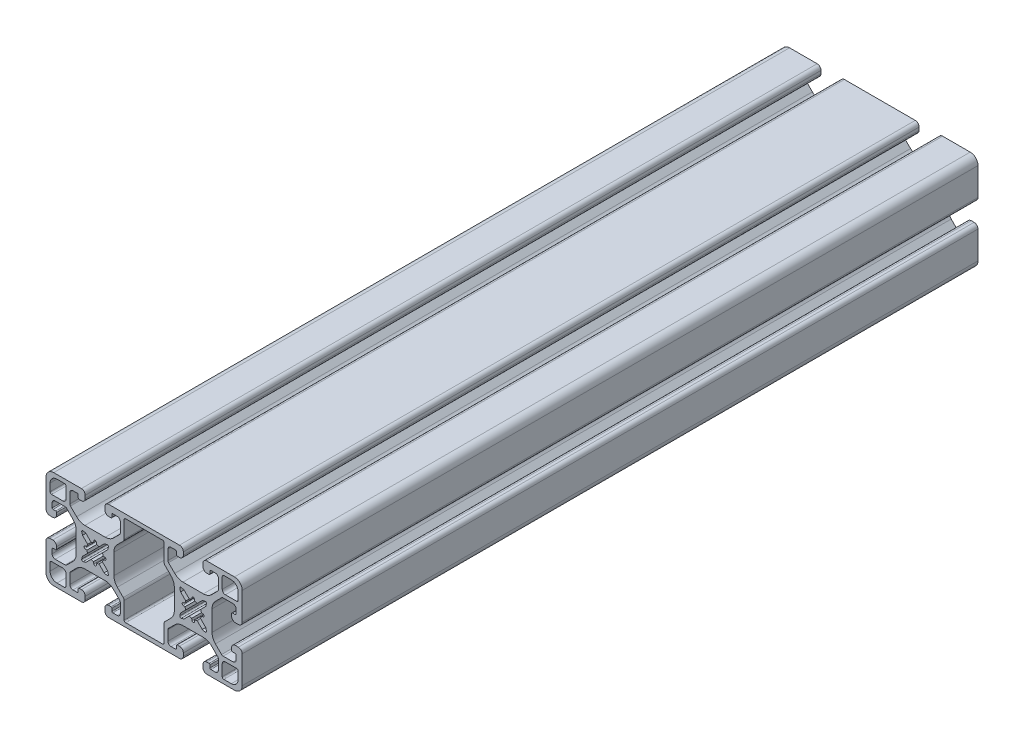
from build123d import *

# Parameters (mm, degrees)
EXTRUDE1_DEPTH = 300


with BuildPart() as part:
    # Sketch1 → Extrude1 (new body)
    with BuildSketch(Plane.XY):
        with BuildLine():
            Line((-24, -18.484793301), (-24, -17.255))
            ThreePointArc((-24, -17.255), (-24.459842354, -16.144842354), (-25.57, -15.685))
            Line((-25.57, -15.685), (-26.474, -15.685))
            ThreePointArc((-26.474, -15.685), (-26.743407684, -15.796592316), (-26.855, -16.066))
            Line((-26.855, -16.066), (-26.855, -17.119))
            ThreePointArc((-26.855, -17.119), (-26.966592316, -17.388407684), (-27.236, -17.5))
            Line((-27.236, -17.5), (-29.015, -17.5))
            ThreePointArc((-29.015, -17.5), (-29.913025612, -17.128025612), (-30.285, -16.23))
            Line((-30.285, -16.23), (-30.285, -12.216214636))
            ThreePointArc((-30.285, -12.216214636), (-30.217252784, -11.875626381), (-30.024325035, -11.5868896))
            Line((-30.024325035, -11.5868896), (-27.513678224, -9.076242789))
            ThreePointArc((-27.513678224, -9.076242789), (-25.972667317, -8.046572221), (-24.154921014, -7.685))
            Line((-24.154921014, -7.685), (-15.845078986, -7.685))
            ThreePointArc((-15.845078986, -7.685), (-14.027332683, -8.046572221), (-12.486321776, -9.076242789))
            Line((-12.486321776, -9.076242789), (-9.975674965, -11.5868896))
            ThreePointArc((-9.975674965, -11.5868896), (-9.782747216, -11.875626381), (-9.715, -12.216214636))
            Line((-9.715, -12.216214636), (-9.715, -16.23))
            ThreePointArc((-9.715, -16.23), (-10.086974388, -17.128025612), (-10.985, -17.5))
            Line((-10.985, -17.5), (-12.764, -17.5))
            ThreePointArc((-12.764, -17.5), (-13.033407684, -17.388407684), (-13.145, -17.119))
            Line((-13.145, -17.119), (-13.145, -16.066))
            ThreePointArc((-13.145, -16.066), (-13.256592316, -15.796592316), (-13.526, -15.685))
            Line((-13.526, -15.685), (-14.43, -15.685))
            ThreePointArc((-14.43, -15.685), (-15.540157646, -16.144842354), (-16, -17.255))
            Line((-16, -17.255), (-16, -18.484793301))
            ThreePointArc((-16, -18.484793301), (-15.521569689, -19.559363866), (-14.43095644, -20))
            Line((-14.43095644, -20), (14.43, -20))
            ThreePointArc((14.43, -20), (15.540157646, -19.540157646), (16, -18.43))
            Line((16, -18.43), (16, -17.255))
            ThreePointArc((16, -17.255), (15.540157646, -16.144842354), (14.43, -15.685))
            Line((14.43, -15.685), (13.526, -15.685))
            ThreePointArc((13.526, -15.685), (13.256592316, -15.796592316), (13.145, -16.066))
            Line((13.145, -16.066), (13.145, -17.119))
            ThreePointArc((13.145, -17.119), (13.033407684, -17.388407684), (12.764, -17.5))
            Line((12.764, -17.5), (10.985, -17.5))
            ThreePointArc((10.985, -17.5), (10.086974388, -17.128025612), (9.715, -16.23))
            Line((9.715, -16.23), (9.715, -12.216214636))
            ThreePointArc((9.715, -12.216214636), (9.782747216, -11.875626381), (9.975674965, -11.5868896))
            Line((9.975674965, -11.5868896), (12.486321776, -9.076242789))
            ThreePointArc((12.486321776, -9.076242789), (14.027332683, -8.046572221), (15.845078986, -7.685))
            Line((15.845078986, -7.685), (24.154921014, -7.685))
            ThreePointArc((24.154921014, -7.685), (25.972667317, -8.046572221), (27.513678224, -9.076242789))
            Line((27.513678224, -9.076242789), (30.024325035, -11.5868896))
            ThreePointArc((30.024325035, -11.5868896), (30.217252784, -11.875626381), (30.285, -12.216214636))
            Line((30.285, -12.216214636), (30.285, -16.23))
            ThreePointArc((30.285, -16.23), (29.913025612, -17.128025612), (29.015, -17.5))
            Line((29.015, -17.5), (27.236, -17.5))
            ThreePointArc((27.236, -17.5), (26.966592316, -17.388407684), (26.855, -17.119))
            Line((26.855, -17.119), (26.855, -16.066))
            ThreePointArc((26.855, -16.066), (26.743407684, -15.796592316), (26.474, -15.685))
            Line((26.474, -15.685), (25.57, -15.685))
            ThreePointArc((25.57, -15.685), (24.459842354, -16.144842354), (24, -17.255))
            Line((24, -17.255), (24, -18.43))
            ThreePointArc((24, -18.43), (24.459842354, -19.540157646), (25.57, -20))
            Line((25.57, -20), (36.83, -20))
            ThreePointArc((36.83, -20), (39.071528496, -19.071528496), (40, -16.83))
            Line((40, -16.83), (40, -5.57))
            ThreePointArc((40, -5.57), (39.540157646, -4.459842354), (38.43, -4))
            Line((38.43, -4), (37.255, -4))
            ThreePointArc((37.255, -4), (36.144842354, -4.459842354), (35.685, -5.57))
            Line((35.685, -5.57), (35.685, -6.474))
            ThreePointArc((35.685, -6.474), (35.796592316, -6.743407684), (36.066, -6.855))
            Line((36.066, -6.855), (37.119, -6.855))
            ThreePointArc((37.119, -6.855), (37.388407684, -6.966592316), (37.5, -7.236))
            Line((37.5, -7.236), (37.5, -9.015))
            ThreePointArc((37.5, -9.015), (37.128025612, -9.913025612), (36.23, -10.285))
            Line((36.23, -10.285), (32.216214636, -10.285))
            ThreePointArc((32.216214636, -10.285), (31.875626381, -10.217252784), (31.5868896, -10.024325035))
            Line((31.5868896, -10.024325035), (29.076242789, -7.513678224))
            ThreePointArc((29.076242789, -7.513678224), (28.046572221, -5.972667317), (27.685, -4.154921014))
            Line((27.685, -4.154921014), (27.685, 4.154921014))
            ThreePointArc((27.685, 4.154921014), (28.046572221, 5.972667317), (29.076242789, 7.513678224))
            Line((29.076242789, 7.513678224), (31.5868896, 10.024325035))
            ThreePointArc((31.5868896, 10.024325035), (31.875626381, 10.217252784), (32.216214636, 10.285))
            Line((32.216214636, 10.285), (36.23, 10.285))
            ThreePointArc((36.23, 10.285), (37.128025612, 9.913025612), (37.5, 9.015))
            Line((37.5, 9.015), (37.5, 7.236))
            ThreePointArc((37.5, 7.236), (37.388407684, 6.966592316), (37.119, 6.855))
            Line((37.119, 6.855), (36.066, 6.855))
            ThreePointArc((36.066, 6.855), (35.796592316, 6.743407684), (35.685, 6.474))
            Line((35.685, 6.474), (35.685, 5.57))
            ThreePointArc((35.685, 5.57), (36.144842354, 4.459842354), (37.255, 4))
            Line((37.255, 4), (38.43, 4))
            ThreePointArc((38.43, 4), (39.540157646, 4.459842354), (40, 5.57))
            Line((40, 5.57), (40, 16.83))
            ThreePointArc((40, 16.83), (39.071528496, 19.071528496), (36.83, 20))
            Line((36.83, 20), (25.57, 20))
            ThreePointArc((25.57, 20), (24.459842354, 19.540157646), (24, 18.43))
            Line((24, 18.43), (24, 17.255))
            ThreePointArc((24, 17.255), (24.459842354, 16.144842354), (25.57, 15.685))
            Line((25.57, 15.685), (26.474, 15.685))
            ThreePointArc((26.474, 15.685), (26.743407684, 15.796592316), (26.855, 16.066))
            Line((26.855, 16.066), (26.855, 17.119))
            ThreePointArc((26.855, 17.119), (26.966592316, 17.388407684), (27.236, 17.5))
            Line((27.236, 17.5), (29.015, 17.5))
            ThreePointArc((29.015, 17.5), (29.913025612, 17.128025612), (30.285, 16.23))
            Line((30.285, 16.23), (30.285, 12.216214636))
            ThreePointArc((30.285, 12.216214636), (30.217252784, 11.875626381), (30.024325035, 11.5868896))
            Line((30.024325035, 11.5868896), (27.513678224, 9.076242789))
            ThreePointArc((27.513678224, 9.076242789), (25.972667317, 8.046572221), (24.154921014, 7.685))
            Line((24.154921014, 7.685), (15.845078986, 7.685))
            ThreePointArc((15.845078986, 7.685), (14.027332683, 8.046572221), (12.486321776, 9.076242789))
            Line((12.486321776, 9.076242789), (9.975674965, 11.5868896))
            ThreePointArc((9.975674965, 11.5868896), (9.782747216, 11.875626381), (9.715, 12.216214636))
            Line((9.715, 12.216214636), (9.715, 16.23))
            ThreePointArc((9.715, 16.23), (10.086974388, 17.128025612), (10.985, 17.5))
            Line((10.985, 17.5), (12.764, 17.5))
            ThreePointArc((12.764, 17.5), (13.033407684, 17.388407684), (13.145, 17.119))
            Line((13.145, 17.119), (13.145, 16.066))
            ThreePointArc((13.145, 16.066), (13.256592316, 15.796592316), (13.526, 15.685))
            Line((13.526, 15.685), (14.43, 15.685))
            ThreePointArc((14.43, 15.685), (15.540157646, 16.144842354), (16, 17.255))
            Line((16, 17.255), (16, 18.43))
            ThreePointArc((16, 18.43), (15.540157646, 19.540157646), (14.43, 20))
            Line((14.43, 20), (-14.43, 20))
            ThreePointArc((-14.43, 20), (-15.540157646, 19.540157646), (-16, 18.43))
            Line((-16, 18.43), (-16, 17.255))
            ThreePointArc((-16, 17.255), (-15.540157646, 16.144842354), (-14.43, 15.685))
            Line((-14.43, 15.685), (-13.526, 15.685))
            ThreePointArc((-13.526, 15.685), (-13.256592316, 15.796592316), (-13.145, 16.066))
            Line((-13.145, 16.066), (-13.145, 17.119))
            ThreePointArc((-13.145, 17.119), (-13.033407684, 17.388407684), (-12.764, 17.5))
            Line((-12.764, 17.5), (-10.985, 17.5))
            ThreePointArc((-10.985, 17.5), (-10.086974388, 17.128025612), (-9.715, 16.23))
            Line((-9.715, 16.23), (-9.715, 12.216214636))
            ThreePointArc((-9.715, 12.216214636), (-9.782747216, 11.875626381), (-9.975674965, 11.5868896))
            Line((-9.975674965, 11.5868896), (-12.486321776, 9.076242789))
            ThreePointArc((-12.486321776, 9.076242789), (-14.027332683, 8.046572221), (-15.845078986, 7.685))
            Line((-15.845078986, 7.685), (-24.154921014, 7.685))
            ThreePointArc((-24.154921014, 7.685), (-25.972667317, 8.046572221), (-27.513678224, 9.076242789))
            Line((-27.513678224, 9.076242789), (-30.024325035, 11.5868896))
            ThreePointArc((-30.024325035, 11.5868896), (-30.217252784, 11.875626381), (-30.285, 12.216214636))
            Line((-30.285, 12.216214636), (-30.285, 16.23))
            ThreePointArc((-30.285, 16.23), (-29.913025612, 17.128025612), (-29.015, 17.5))
            Line((-29.015, 17.5), (-27.236, 17.5))
            ThreePointArc((-27.236, 17.5), (-26.966592316, 17.388407684), (-26.855, 17.119))
            Line((-26.855, 17.119), (-26.855, 16.066))
            ThreePointArc((-26.855, 16.066), (-26.743407684, 15.796592316), (-26.474, 15.685))
            Line((-26.474, 15.685), (-25.57, 15.685))
            ThreePointArc((-25.57, 15.685), (-24.459842354, 16.144842354), (-24, 17.255))
            Line((-24, 17.255), (-24, 18.43))
            ThreePointArc((-24, 18.43), (-24.459842354, 19.540157646), (-25.57, 20))
            Line((-25.57, 20), (-36.83, 20))
            ThreePointArc((-36.83, 20), (-39.071528496, 19.071528496), (-40, 16.83))
            Line((-40, 16.83), (-40, 5.57))
            ThreePointArc((-40, 5.57), (-39.540157646, 4.459842354), (-38.43, 4))
            Line((-38.43, 4), (-37.255, 4))
            ThreePointArc((-37.255, 4), (-36.144842354, 4.459842354), (-35.685, 5.57))
            Line((-35.685, 5.57), (-35.685, 6.474))
            ThreePointArc((-35.685, 6.474), (-35.796592316, 6.743407684), (-36.066, 6.855))
            Line((-36.066, 6.855), (-37.119, 6.855))
            ThreePointArc((-37.119, 6.855), (-37.388407684, 6.966592316), (-37.5, 7.236))
            Line((-37.5, 7.236), (-37.5, 9.015))
            ThreePointArc((-37.5, 9.015), (-37.128025612, 9.913025612), (-36.23, 10.285))
            Line((-36.23, 10.285), (-32.216214636, 10.285))
            ThreePointArc((-32.216214636, 10.285), (-31.875626381, 10.217252784), (-31.5868896, 10.024325035))
            Line((-31.5868896, 10.024325035), (-29.076242789, 7.513678224))
            ThreePointArc((-29.076242789, 7.513678224), (-28.046572221, 5.972667317), (-27.685, 4.154921014))
            Line((-27.685, 4.154921014), (-27.685, -4.154921014))
            ThreePointArc((-27.685, -4.154921014), (-28.046572221, -5.972667317), (-29.076242789, -7.513678224))
            Line((-29.076242789, -7.513678224), (-31.5868896, -10.024325035))
            ThreePointArc((-31.5868896, -10.024325035), (-31.875626381, -10.217252784), (-32.216214636, -10.285))
            Line((-32.216214636, -10.285), (-36.23, -10.285))
            ThreePointArc((-36.23, -10.285), (-37.128025612, -9.913025612), (-37.5, -9.015))
            Line((-37.5, -9.015), (-37.5, -7.236))
            ThreePointArc((-37.5, -7.236), (-37.388407684, -6.966592316), (-37.119, -6.855))
            Line((-37.119, -6.855), (-36.066, -6.855))
            ThreePointArc((-36.066, -6.855), (-35.796592316, -6.743407684), (-35.685, -6.474))
            Line((-35.685, -6.474), (-35.685, -5.57))
            ThreePointArc((-35.685, -5.57), (-36.144842354, -4.459842354), (-37.255, -4))
            Line((-37.255, -4), (-38.43, -4))
            ThreePointArc((-38.43, -4), (-39.540157646, -4.459842354), (-40, -5.57))
            Line((-40, -5.57), (-40, -16.83))
            ThreePointArc((-40, -16.83), (-39.071528496, -19.071528496), (-36.83, -20))
            Line((-36.83, -20), (-25.56904356, -20))
            ThreePointArc((-25.56904356, -20), (-24.478430311, -19.559363866), (-24, -18.484793301))
        make_face()
        with BuildLine():
            Line((35.545, -18.345), (32.4898, -18.345))
            ThreePointArc((32.4898, -18.345), (32.044322728, -18.160477272), (31.8598, -17.715))
            Line((31.8598, -17.715), (31.8598, -13.1298))
            ThreePointArc((31.8598, -13.1298), (32.231774388, -12.231774388), (33.1298, -11.8598))
            Line((33.1298, -11.8598), (37.715, -11.8598))
            ThreePointArc((37.715, -11.8598), (38.160477272, -12.044322728), (38.345, -12.4898))
            Line((38.345, -12.4898), (38.345, -15.545))
            ThreePointArc((38.345, -15.545), (37.524898987, -17.524898987), (35.545, -18.345))
        make_face(mode=Mode.SUBTRACT)
        with BuildLine():
            Line((8.1402, 17.715), (8.1402, 10.823286659))
            ThreePointArc((8.1402, 10.823286659), (8.236872994, 10.3372787), (8.512174388, 9.925261047))
            Line((8.512174388, 9.925261047), (10.923757211, 7.513678224))
            ThreePointArc((10.923757211, 7.513678224), (11.953427779, 5.972667317), (12.315, 4.154921014))
            Line((12.315, 4.154921014), (12.315, -4.154921014))
            ThreePointArc((12.315, -4.154921014), (11.953427779, -5.972667317), (10.923757211, -7.513678224))
            Line((10.923757211, -7.513678224), (8.512174388, -9.925261047))
            ThreePointArc((8.512174388, -9.925261047), (8.236872994, -10.3372787), (8.1402, -10.823286659))
            Line((8.1402, -10.823286659), (8.1402, -17.715))
            ThreePointArc((8.1402, -17.715), (7.955677272, -18.160477272), (7.5102, -18.345))
            Line((7.5102, -18.345), (-7.5102, -18.345))
            ThreePointArc((-7.5102, -18.345), (-7.955677272, -18.160477272), (-8.1402, -17.715))
            Line((-8.1402, -17.715), (-8.1402, -10.823286659))
            ThreePointArc((-8.1402, -10.823286659), (-8.236872994, -10.3372787), (-8.512174388, -9.925261047))
            Line((-8.512174388, -9.925261047), (-10.923757211, -7.513678224))
            ThreePointArc((-10.923757211, -7.513678224), (-11.953427779, -5.972667317), (-12.315, -4.154921014))
            Line((-12.315, -4.154921014), (-12.315, 4.154921014))
            ThreePointArc((-12.315, 4.154921014), (-11.953427779, 5.972667317), (-10.923757211, 7.513678224))
            Line((-10.923757211, 7.513678224), (-8.512174388, 9.925261047))
            ThreePointArc((-8.512174388, 9.925261047), (-8.236872994, 10.3372787), (-8.1402, 10.823286659))
            Line((-8.1402, 10.823286659), (-8.1402, 17.715))
            ThreePointArc((-8.1402, 17.715), (-7.955677272, 18.160477272), (-7.5102, 18.345))
            Line((-7.5102, 18.345), (7.5102, 18.345))
            ThreePointArc((7.5102, 18.345), (7.955677272, 18.160477272), (8.1402, 17.715))
        make_face(mode=Mode.SUBTRACT)
        with BuildLine():
            Line((-38.345, -15.545), (-38.345, -12.4898))
            ThreePointArc((-38.345, -12.4898), (-38.160477272, -12.044322728), (-37.715, -11.8598))
            Line((-37.715, -11.8598), (-33.1298, -11.8598))
            ThreePointArc((-33.1298, -11.8598), (-32.231774388, -12.231774388), (-31.8598, -13.1298))
            Line((-31.8598, -13.1298), (-31.8598, -17.715))
            ThreePointArc((-31.8598, -17.715), (-32.044322728, -18.160477272), (-32.4898, -18.345))
            Line((-32.4898, -18.345), (-35.545, -18.345))
            ThreePointArc((-35.545, -18.345), (-37.524898987, -17.524898987), (-38.345, -15.545))
        make_face(mode=Mode.SUBTRACT)
        with BuildLine():
            Line((-35.545, 18.345), (-32.4898, 18.345))
            ThreePointArc((-32.4898, 18.345), (-32.044322728, 18.160477272), (-31.8598, 17.715))
            Line((-31.8598, 17.715), (-31.8598, 13.1298))
            ThreePointArc((-31.8598, 13.1298), (-32.231774388, 12.231774388), (-33.1298, 11.8598))
            Line((-33.1298, 11.8598), (-37.715, 11.8598))
            ThreePointArc((-37.715, 11.8598), (-38.160477272, 12.044322728), (-38.345, 12.4898))
            Line((-38.345, 12.4898), (-38.345, 15.545))
            ThreePointArc((-38.345, 15.545), (-37.524898987, 17.524898987), (-35.545, 18.345))
        make_face(mode=Mode.SUBTRACT)
        with BuildLine():
            Line((38.345, 15.545), (38.345, 12.4898))
            ThreePointArc((38.345, 12.4898), (38.160477272, 12.044322728), (37.715, 11.8598))
            Line((37.715, 11.8598), (33.1298, 11.8598))
            ThreePointArc((33.1298, 11.8598), (32.231774388, 12.231774388), (31.8598, 13.1298))
            Line((31.8598, 13.1298), (31.8598, 17.715))
            ThreePointArc((31.8598, 17.715), (32.044322728, 18.160477272), (32.4898, 18.345))
            Line((32.4898, 18.345), (35.545, 18.345))
            ThreePointArc((35.545, 18.345), (37.524898987, 17.524898987), (38.345, 15.545))
        make_face(mode=Mode.SUBTRACT)
        with BuildLine():
            Line((-14.873747818, -3.712038616), (-14.560690261, -4.84811685))
            ThreePointArc((-14.560690261, -4.84811685), (-14.696699139, -5.303300857), (-15.151883146, -5.43930974))
            Line((-15.151883146, -5.43930974), (-16.28796138, -5.126252183))
            Line((-16.28796138, -5.126252183), (-18.409281723, -3.00493184))
            ThreePointArc((-18.409281723, -3.00493184), (-18.879390357, -3.210020877), (-19.375, -3.34206149))
            Line((-19.375, -3.34206149), (-19.507740766, -4.087640441))
            ThreePointArc((-19.507740766, -4.087640441), (-20, -4.5), (-20.492259234, -4.087640441))
            Line((-20.492259234, -4.087640441), (-20.625, -3.34206149))
            ThreePointArc((-20.625, -3.34206149), (-21.120609643, -3.210020877), (-21.590718277, -3.00493184))
            Line((-21.590718277, -3.00493184), (-23.71203862, -5.126252183))
            Line((-23.71203862, -5.126252183), (-24.848116854, -5.43930974))
            ThreePointArc((-24.848116854, -5.43930974), (-25.303300871, -5.303300847), (-25.439309734, -4.848116822))
            Line((-25.439309734, -4.848116822), (-25.126252208, -3.712038579))
            Line((-25.126252208, -3.712038579), (-23.004931858, -1.590718243))
            ThreePointArc((-23.004931858, -1.590718243), (-23.210020883, -1.120609625), (-23.34206149, -0.625))
            Line((-23.34206149, -0.625), (-24.087640441, -0.492259234))
            ThreePointArc((-24.087640441, -0.492259234), (-24.5, 0), (-24.087640441, 0.492259234))
            Line((-24.087640441, 0.492259234), (-23.34206149, 0.625))
            ThreePointArc((-23.34206149, 0.625), (-23.210020877, 1.120609643), (-23.00493184, 1.590718277))
            Line((-23.00493184, 1.590718277), (-25.126252183, 3.71203862))
            Line((-25.126252183, 3.71203862), (-25.43930974, 4.848116854))
            ThreePointArc((-25.43930974, 4.848116854), (-25.303300847, 5.303300871), (-24.848116822, 5.439309734))
            Line((-24.848116822, 5.439309734), (-23.712038579, 5.126252209))
            Line((-23.712038579, 5.126252209), (-21.590718243, 3.004931858))
            ThreePointArc((-21.590718243, 3.004931858), (-21.120609625, 3.210020883), (-20.625, 3.34206149))
            Line((-20.625, 3.34206149), (-20.492259234, 4.087640441))
            ThreePointArc((-20.492259234, 4.087640441), (-20, 4.5), (-19.507740766, 4.087640441))
            Line((-19.507740766, 4.087640441), (-19.375, 3.34206149))
            ThreePointArc((-19.375, 3.34206149), (-18.879390364, 3.210020879), (-18.409281735, 3.004931846))
            Line((-18.409281735, 3.004931846), (-16.287961384, 5.126252182))
            Line((-16.287961384, 5.126252182), (-15.15188315, 5.43930974))
            ThreePointArc((-15.15188315, 5.43930974), (-14.696699143, 5.303300861), (-14.56069026, 4.848116854))
            Line((-14.56069026, 4.848116854), (-14.873747817, 3.71203862))
            Line((-14.873747817, 3.71203862), (-16.99506816, 1.590718277))
            ThreePointArc((-16.99506816, 1.590718277), (-16.789979123, 1.120609643), (-16.65793851, 0.625))
            Line((-16.65793851, 0.625), (-15.912359559, 0.492259234))
            ThreePointArc((-15.912359559, 0.492259234), (-15.5, 0), (-15.912359559, -0.492259234))
            Line((-15.912359559, -0.492259234), (-16.65793851, -0.625))
            ThreePointArc((-16.65793851, -0.625), (-16.789979121, -1.120609636), (-16.995068154, -1.590718265))
            Line((-16.995068154, -1.590718265), (-14.873747818, -3.712038616))
        make_face(mode=Mode.SUBTRACT)
        with BuildLine():
            Line((25.126252183, -3.712038621), (25.43930974, -4.848116855))
            ThreePointArc((25.43930974, -4.848116855), (25.303300859, -5.303300858), (24.848116855, -5.43930974))
            Line((24.848116855, -5.43930974), (23.712038621, -5.126252182))
            Line((23.712038621, -5.126252182), (21.590718278, -3.00493184))
            ThreePointArc((21.590718278, -3.00493184), (21.120609643, -3.210020877), (20.625, -3.34206149))
            Line((20.625, -3.34206149), (20.492259234, -4.087640441))
            ThreePointArc((20.492259234, -4.087640441), (20, -4.5), (19.507740766, -4.087640441))
            Line((19.507740766, -4.087640441), (19.375, -3.34206149))
            ThreePointArc((19.375, -3.34206149), (18.879390357, -3.210020877), (18.409281723, -3.00493184))
            Line((18.409281723, -3.00493184), (16.28796138, -5.126252183))
            Line((16.28796138, -5.126252183), (15.151883146, -5.43930974))
            ThreePointArc((15.151883146, -5.43930974), (14.696699139, -5.30330086), (14.560690257, -4.848116854))
            Line((14.560690257, -4.848116854), (14.873747817, -3.712038621))
            Line((14.873747817, -3.712038621), (16.995068161, -1.590718279))
            ThreePointArc((16.995068161, -1.590718279), (16.789979124, -1.120609644), (16.65793851, -0.625))
            Line((16.65793851, -0.625), (15.912359559, -0.492259234))
            ThreePointArc((15.912359559, -0.492259234), (15.5, 0), (15.912359559, 0.492259234))
            Line((15.912359559, 0.492259234), (16.65793851, 0.625))
            ThreePointArc((16.65793851, 0.625), (16.789979123, 1.120609643), (16.99506816, 1.590718277))
            Line((16.99506816, 1.590718277), (14.873747817, 3.71203862))
            Line((14.873747817, 3.71203862), (14.560690259, 4.848116854))
            ThreePointArc((14.560690259, 4.848116854), (14.69669914, 5.303300859), (15.151883146, 5.43930974))
            Line((15.151883146, 5.43930974), (16.287961379, 5.126252183))
            Line((16.287961379, 5.126252183), (18.409281723, 3.00493184))
            ThreePointArc((18.409281723, 3.00493184), (18.879390357, 3.210020877), (19.375, 3.34206149))
            Line((19.375, 3.34206149), (19.507740766, 4.087640441))
            ThreePointArc((19.507740766, 4.087640441), (20, 4.5), (20.492259234, 4.087640441))
            Line((20.492259234, 4.087640441), (20.625, 3.34206149))
            ThreePointArc((20.625, 3.34206149), (21.120609646, 3.210020876), (21.590718283, 3.004931837))
            Line((21.590718283, 3.004931837), (23.712038628, 5.126252178))
            Line((23.712038628, 5.126252178), (24.84811686, 5.439309741))
            ThreePointArc((24.84811686, 5.439309741), (25.303300861, 5.303300856), (25.43930974, 4.848116854))
            Line((25.43930974, 4.848116854), (25.126252183, 3.71203862))
            Line((25.126252183, 3.71203862), (23.00493184, 1.590718277))
            ThreePointArc((23.00493184, 1.590718277), (23.210020877, 1.120609643), (23.34206149, 0.625))
            Line((23.34206149, 0.625), (24.087640441, 0.492259234))
            ThreePointArc((24.087640441, 0.492259234), (24.5, 0), (24.087640441, -0.492259234))
            Line((24.087640441, -0.492259234), (23.34206149, -0.625))
            ThreePointArc((23.34206149, -0.625), (23.210020877, -1.120609643), (23.00493184, -1.590718278))
            Line((23.00493184, -1.590718278), (25.126252183, -3.712038621))
        make_face(mode=Mode.SUBTRACT)
    extrude(amount=-EXTRUDE1_DEPTH)


solid = part.part
